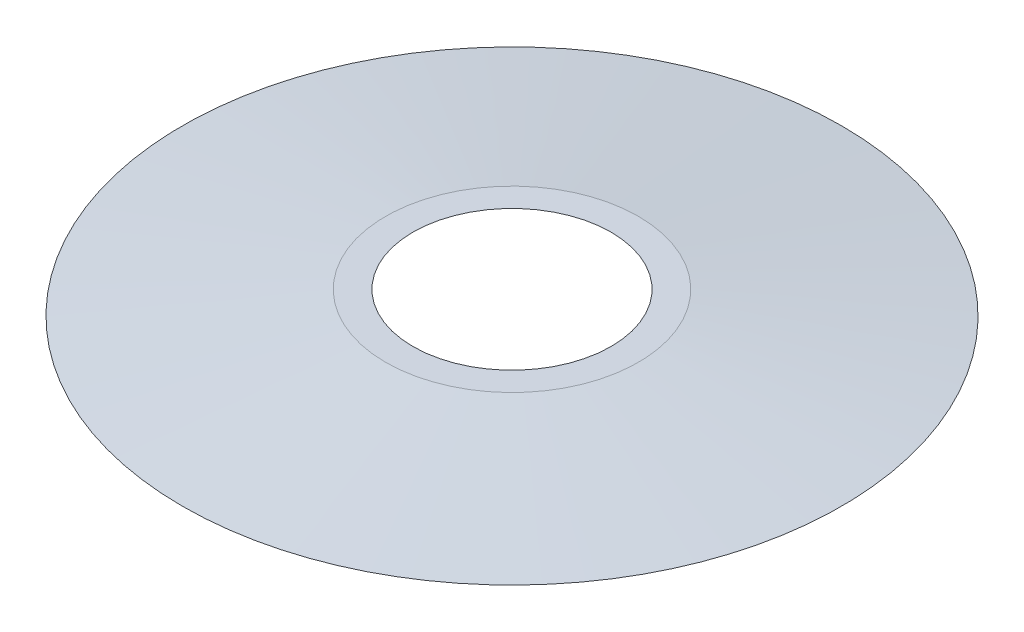
from build123d import *


with BuildPart() as part:
    # 草图1 → 旋转1 (revolve)
    with BuildSketch(Plane.XY, mode=Mode.PRIVATE) as revolve_1_sk:
        Polygon((14.652252851, 1.708071429), (18.699201208, 1.708071429), (48.746149565, -1.708071429), (37.695264246, -1.708071429), align=None)
    revolve(revolve_1_sk.sketch.rotate(Axis((0, 0, 0), (0, -1, 0)), 90), axis=Axis((0, 0, 0), (0, -1, 0)))


solid = part.part
